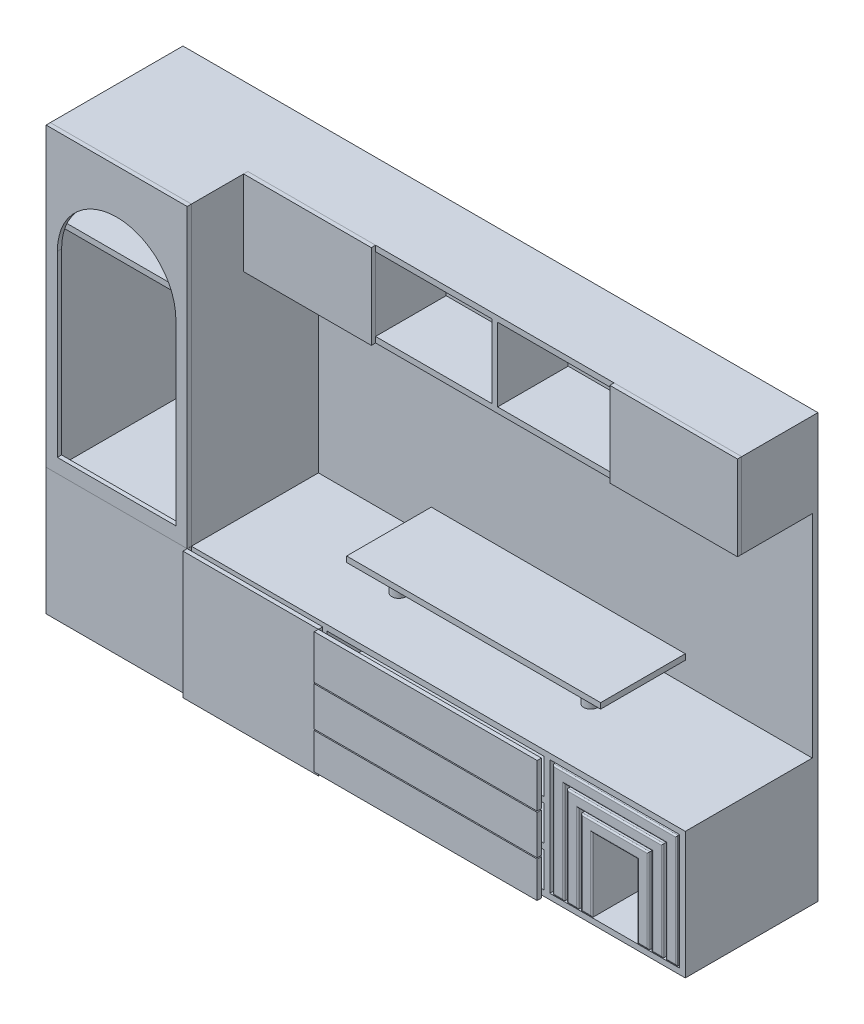
from build123d import *

# Parameters (mm, degrees)
SKETCH1_W              = 2250
SKETCH1_H              = 1500
BOSS_EXTRUDE1_DEPTH    = 20
BOSS_EXTRUDE2_DEPTH    = 450
SKETCH4_W              = 1750
SKETCH4_H              = 300
BOSS_EXTRUDE3_DEPTH    = 250
SKETCH5_W              = 412.5
SKETCH5_H              = 260
CUT_EXTRUDE1_DEPTH     = 250
SKETCH6_W              = 460
SKETCH6_H              = 260
SKETCH6_H_2            = 750
SKETCH6_H_3            = 410
SKETCH6_W_2            = 770
SKETCH6_H_4            = 123.333333333
SKETCH6_H_5            = 123.333333334
CUT_EXTRUDE2_DEPTH     = 450
SKETCH7_W              = 900
SKETCH7_H              = 20
BOSS_EXTRUDE6_DEPTH    = 300
SKETCH10_R             = 25
BOSS_EXTRUDE7_DEPTH    = 100
BOSS_EXTRUDE8_DEPTH    = 450
BOSS_EXTRUDE8_2_DEPTH  = 450
BOSS_EXTRUDE8_3_DEPTH  = 450
FILLET1_R              = 5
FILLET2_R              = 5
FILLET3_R              = 5
SKETCH13_W             = 452.5
SKETCH13_H             = 300
BOSS_EXTRUDE9_DEPTH    = 15
BOSS_EXTRUDE9_2_DEPTH  = 15
SKETCH14_W             = 500
SKETCH14_H             = 1050
BOSS_EXTRUDE10_DEPTH   = 15
SKETCH15_W             = 500.235374178
SKETCH15_H             = 450
BOSS_EXTRUDE11_DEPTH   = 15
SKETCH16_W             = 480
SKETCH16_H             = 450
BOSS_EXTRUDE12_DEPTH   = 15
SKETCH17_W             = 790
SKETCH17_H             = 155.333333333
BOSS_EXTRUDE13_DEPTH   = 15
SKETCH17_H_2           = 139.333333334
BOSS_EXTRUDE13_2_DEPTH = 15
SKETCH17_H_3           = 127.333333333
BOSS_EXTRUDE13_3_DEPTH = 15
CUT_EXTRUDE3_DEPTH     = 15


with BuildPart() as part:
    # Sketch1 → Boss-Extrude1 (new body)
    with BuildSketch(Plane.XY):
        Rectangle(SKETCH1_W, SKETCH1_H)
    extrude(amount=BOSS_EXTRUDE1_DEPTH)

    # Sketch2 → Boss-Extrude2 (add)
    with BuildSketch(Plane.XY.offset(20)):
        Polygon((-625, 750), (-625, -300), (1125, -300), (1125, -750), (-1125, -750), (-1125, 750), align=None)
    extrude(amount=BOSS_EXTRUDE2_DEPTH)

    # Sketch4 → Boss-Extrude3 (add)
    with BuildSketch(Plane.XY.offset(20)):
        with Locations((250, 600)):
            Rectangle(SKETCH4_W, SKETCH4_H)
    extrude(amount=BOSS_EXTRUDE3_DEPTH)

    # Sketch5 → Cut-Extrude1 (cut)
    with BuildSketch(Plane.XY.offset(270)):
        with Locations((-398.75, 600)):
            Rectangle(SKETCH5_W, SKETCH5_H)
        with Locations((33.75, 600)):
            Rectangle(SKETCH5_W, SKETCH5_H)
        with Locations((466.25, 600)):
            Rectangle(SKETCH5_W, SKETCH5_H)
        with Locations((898.75, 600)):
            Rectangle(SKETCH5_W, SKETCH5_H)
    extrude(amount=-CUT_EXTRUDE1_DEPTH, mode=Mode.SUBTRACT)

    # Sketch6 → Cut-Extrude2 (cut)
    with BuildSketch(Plane.XY.offset(470)):
        with Locations((-875, 600)):
            Rectangle(SKETCH6_W, SKETCH6_H)
        with Locations((-875, 75)):
            Rectangle(SKETCH6_W, SKETCH6_H_2)
        with Locations((-875, -525)):
            Rectangle(SKETCH6_W, SKETCH6_H_3)
        with Locations((-395, -525)):
            Rectangle(SKETCH6_W, SKETCH6_H_3)
        with Locations((875, -525)):
            Rectangle(SKETCH6_W, SKETCH6_H_3)
        with Locations((240, -381.666666667)):
            Rectangle(SKETCH6_W_2, SKETCH6_H_4)
        with Locations((240, -525)):
            Rectangle(SKETCH6_W_2, SKETCH6_H_5)
        with Locations((240, -668.333333334)):
            Rectangle(SKETCH6_W_2, SKETCH6_H_4)
    extrude(amount=-CUT_EXTRUDE2_DEPTH, mode=Mode.SUBTRACT)



with BuildPart() as body_2:
    # Sketch7 → Boss-Extrude6 (new body)
    with BuildSketch(Plane.XY.offset(20)):
        with Locations((225, -215)):
            Rectangle(SKETCH7_W, SKETCH7_H)
    extrude(amount=BOSS_EXTRUDE6_DEPTH)


with BuildPart() as part_1:
    add(part.part)

    add(body_2.part)  # Boss-Extrude7 merges body 2
    # Sketch10 → Boss-Extrude7 (add)
    with BuildSketch(Plane.XZ.offset(225)):
        with Locations(Location((-115, 245, 0), (0, 0, 90))):
            Circle(SKETCH10_R)
        with Locations(Location((-115, 95, 0), (0, 0, 180))):
            Circle(SKETCH10_R)
        with Locations(Location((565, 245, 0), (0, 0, 180))):
            Circle(SKETCH10_R)
        with Locations(Location((565, 95, 0), (0, 0, 180))):
            Circle(SKETCH10_R)
    extrude(amount=BOSS_EXTRUDE7_DEPTH)


with BuildPart() as body_2_2:
    # Sketch11 → Boss-Extrude8 (new body)
    with BuildSketch(Plane.XY.offset(20)):
        Polygon((1095, -330), (655, -330), (655, -730), (695, -730), (695, -370), (1055, -370), (1055, -730), (1095, -730), align=None)
    extrude(amount=BOSS_EXTRUDE8_DEPTH)

    # Fillet1
    fillet1_edges = [body_2_2.edges().sort_by_distance(p)[0] for p in [
        (655, -530, 470),
        (675, -730, 470),
        (695, -550, 470),
        (875, -330, 470),
        (1095, -530, 470),
        (875, -370, 470),
        (1055, -550, 470),
        (1075, -730, 470),
    ]]
    fillet(fillet1_edges, radius=FILLET1_R)


with BuildPart() as body_3:
    # Sketch11 → Boss-Extrude8 2 (new body)
    with BuildSketch(Plane.XY.offset(20)):
        Polygon((705, -380), (705, -730), (745, -730), (745, -420), (1005, -420), (1005, -730), (1045, -730), (1045, -380), align=None)
    extrude(amount=BOSS_EXTRUDE8_2_DEPTH)

    # Fillet2
    fillet2_edges = [body_3.edges().sort_by_distance(p)[0] for p in [
        (705, -555, 470),
        (725, -730, 470),
        (745, -575, 470),
        (875, -380, 470),
        (1045, -555, 470),
        (875, -420, 470),
        (1005, -575, 470),
        (1025, -730, 470),
    ]]
    fillet(fillet2_edges, radius=FILLET2_R)


with BuildPart() as body_4:
    # Sketch11 → Boss-Extrude8 3 (new body)
    with BuildSketch(Plane.XY.offset(20)):
        Polygon((755, -430), (755, -730), (795, -730), (795, -470), (955, -470), (955, -730), (995, -730), (995, -430), align=None)
    extrude(amount=BOSS_EXTRUDE8_3_DEPTH)

    # Fillet3
    fillet3_edges = [body_4.edges().sort_by_distance(p)[0] for p in [
        (755, -580, 470),
        (775, -730, 470),
        (795, -600, 470),
        (875, -430, 470),
        (995, -580, 470),
        (875, -470, 470),
        (955, -600, 470),
        (975, -730, 470),
    ]]
    fillet(fillet3_edges, radius=FILLET3_R)


with BuildPart() as body_5:
    # Sketch13 → Boss-Extrude9 (new body)
    with BuildSketch(Plane.XY.offset(270)):
        with Locations((-398.75, 600)):
            Rectangle(SKETCH13_W, SKETCH13_H)
    extrude(amount=BOSS_EXTRUDE9_DEPTH)


with BuildPart() as body_6:
    # Sketch13 → Boss-Extrude9 2 (new body)
    with BuildSketch(Plane.XY.offset(270)):
        with Locations((898.75, 600)):
            Rectangle(SKETCH13_W, SKETCH13_H)
    extrude(amount=BOSS_EXTRUDE9_2_DEPTH)


with BuildPart() as body_7:
    # Sketch14 → Boss-Extrude10 (new body)
    with BuildSketch(Plane.XY.offset(470)):
        with Locations((-875, 225)):
            Rectangle(SKETCH14_W, SKETCH14_H)
    extrude(amount=BOSS_EXTRUDE10_DEPTH)

    # Sketch18 → Cut-Extrude3 (cut)
    with BuildSketch(Plane.XY.offset(485)):
        with BuildLine():
            Line((-1085, 382.606281643), (-1085, -250))
            Line((-1085, -250), (-665, -250))
            Line((-665, -250), (-665, 382.606281643))
            ThreePointArc((-665, 382.606281643), (-875, 592.606281643), (-1085, 382.606281643))
        make_face()
    extrude(amount=-CUT_EXTRUDE3_DEPTH, mode=Mode.SUBTRACT)


with BuildPart() as body_8:
    # Sketch15 → Boss-Extrude11 (new body)
    with BuildSketch(Plane.XY.offset(470)):
        with Locations((-874.882312911, -525)):
            Rectangle(SKETCH15_W, SKETCH15_H)
    extrude(amount=BOSS_EXTRUDE11_DEPTH)


with BuildPart() as body_9:
    # Sketch16 → Boss-Extrude12 (new body)
    with BuildSketch(Plane.XY.offset(485)):
        with Locations((-385, -525)):
            Rectangle(SKETCH16_W, SKETCH16_H)
    extrude(amount=BOSS_EXTRUDE12_DEPTH)


with BuildPart() as body_10:
    # Sketch17 → Boss-Extrude13 (new body)
    with BuildSketch(Plane.XY.offset(500)):
        with Locations((250, -377.666666667)):
            Rectangle(SKETCH17_W, SKETCH17_H)
    extrude(amount=BOSS_EXTRUDE13_DEPTH)


with BuildPart() as body_11:
    # Sketch17 → Boss-Extrude13 2 (new body)
    with BuildSketch(Plane.XY.offset(500)):
        with Locations((250, -529)):
            Rectangle(SKETCH17_W, SKETCH17_H_2)
    extrude(amount=BOSS_EXTRUDE13_2_DEPTH)


with BuildPart() as body_12:
    # Sketch17 → Boss-Extrude13 3 (new body)
    with BuildSketch(Plane.XY.offset(500)):
        with Locations((250, -666.333333334)):
            Rectangle(SKETCH17_W, SKETCH17_H_3)
    extrude(amount=BOSS_EXTRUDE13_3_DEPTH)


solid = Compound([part_1.part, body_2_2.part, body_3.part, body_4.part, body_5.part, body_6.part, body_7.part, body_8.part, body_9.part, body_10.part, body_11.part, body_12.part])
